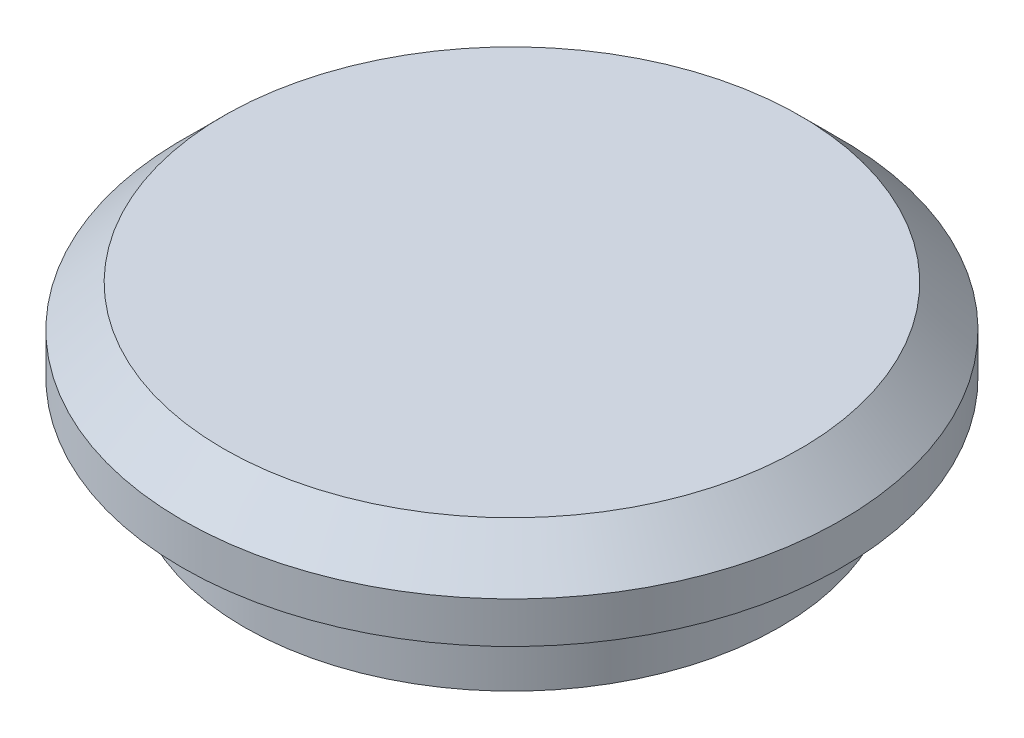
from build123d import *

# Parameters (mm, degrees)
SKETCH1_R           = 6.5
BOSS_EXTRUDE1_DEPTH = 4
SKETCH2_R           = 8
BOSS_EXTRUDE2_DEPTH = 2
CHAMFER1_SIZE       = 1


with BuildPart() as part:
    # Sketch1 → Boss-Extrude1 (new body)
    with BuildSketch(Plane(origin=(0, 0, 0), x_dir=(1, 0, 0), z_dir=(0, 1, 0))):
        with Locations(Location((0, 0, 0), (0, 0, 270))):
            Circle(SKETCH1_R)
    extrude(amount=BOSS_EXTRUDE1_DEPTH)

    # Sketch2 → Boss-Extrude2 (add)
    with BuildSketch(Plane(origin=(0, 4, 0), x_dir=(1, 0, 0), z_dir=(0, 1, 0))):
        with Locations(Location((0, 0, 0), (0, 0, 270))):
            Circle(SKETCH2_R)
    extrude(amount=-BOSS_EXTRUDE2_DEPTH)

    # Chamfer1
    chamfer1_edges = [part.edges().sort_by_distance(p)[0] for p in [
        (0, 4, -8),
    ]]
    chamfer(chamfer1_edges, length=CHAMFER1_SIZE)


solid = part.part
